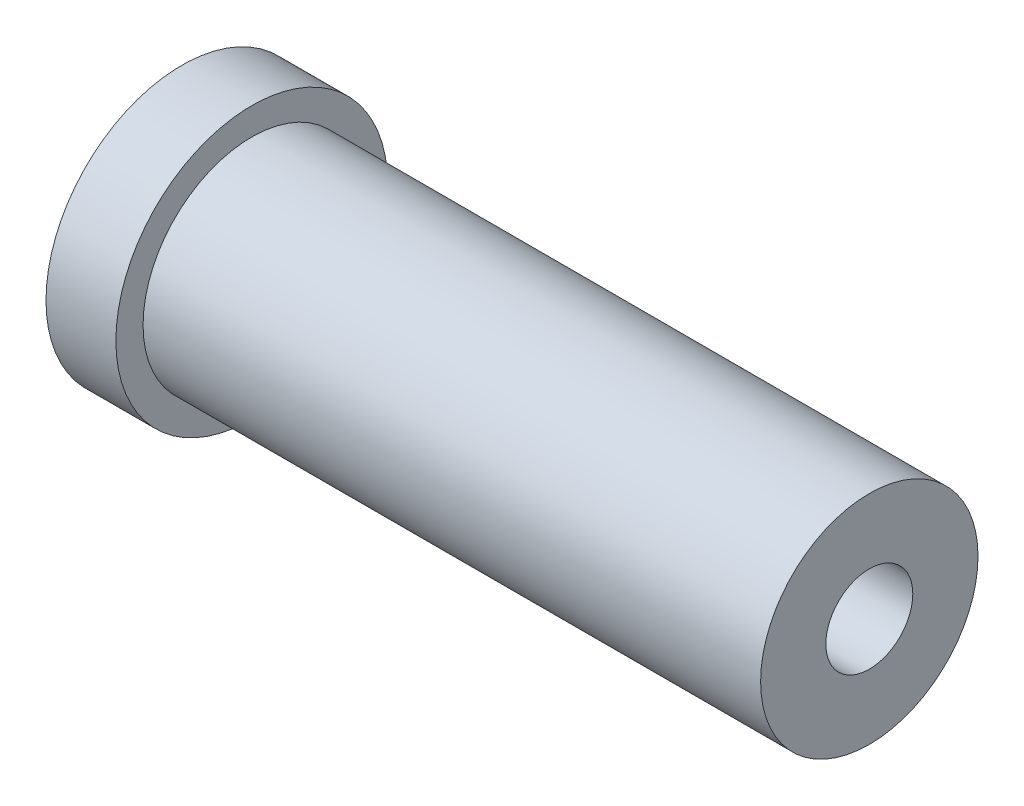
from build123d import *

# Parameters (mm, degrees)
SKETCH1_R           = 10
BOSS_EXTRUDE1_DEPTH = 63.25
SKETCH2_R           = 12.5
BOSS_EXTRUDE2_DEPTH = 6.43
SKETCH3_R           = 4
CUT_EXTRUDE1_DEPTH  = 66.673910345


with BuildPart() as part:
    # Sketch1 → Boss-Extrude1 (new body)
    with BuildSketch(Plane(origin=(0, 0, 0), x_dir=(0, 0, -1), z_dir=(1, 0, 0))):
        Circle(SKETCH1_R)
    extrude(amount=BOSS_EXTRUDE1_DEPTH)

    # Sketch2 → Boss-Extrude2 (add)
    with BuildSketch(Plane.ZY):
        Circle(SKETCH2_R)
    extrude(amount=-BOSS_EXTRUDE2_DEPTH)

    # Sketch3 → Cut-Extrude1 (cut, through all)
    with BuildSketch(Plane(origin=(63.25, 0, 0), x_dir=(0, 0, -1), z_dir=(1, 0, 0))):
        Circle(SKETCH3_R)
    extrude(amount=-CUT_EXTRUDE1_DEPTH, mode=Mode.SUBTRACT)


solid = part.part
